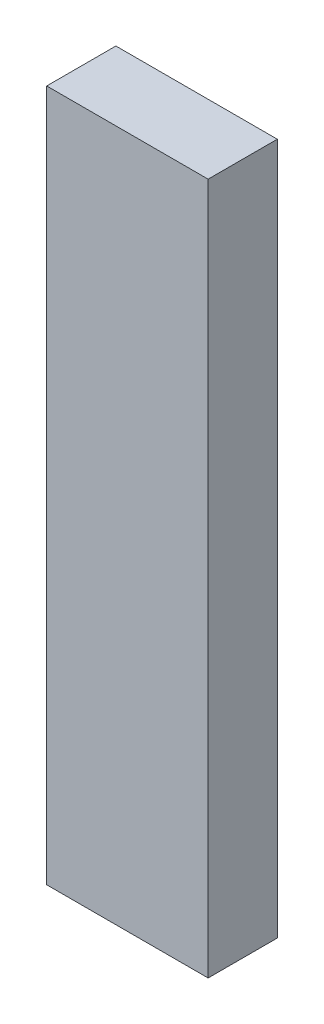
from build123d import *

# Parameters (mm, degrees)
SKETCH1_W           = 7
SKETCH1_H           = 30
BOSS_EXTRUDE1_DEPTH = 3


with BuildPart() as part:
    # Sketch1 → Boss-Extrude1 (new body)
    with BuildSketch(Plane.XY):
        Rectangle(SKETCH1_W, SKETCH1_H)
    extrude(amount=BOSS_EXTRUDE1_DEPTH)


solid = part.part
